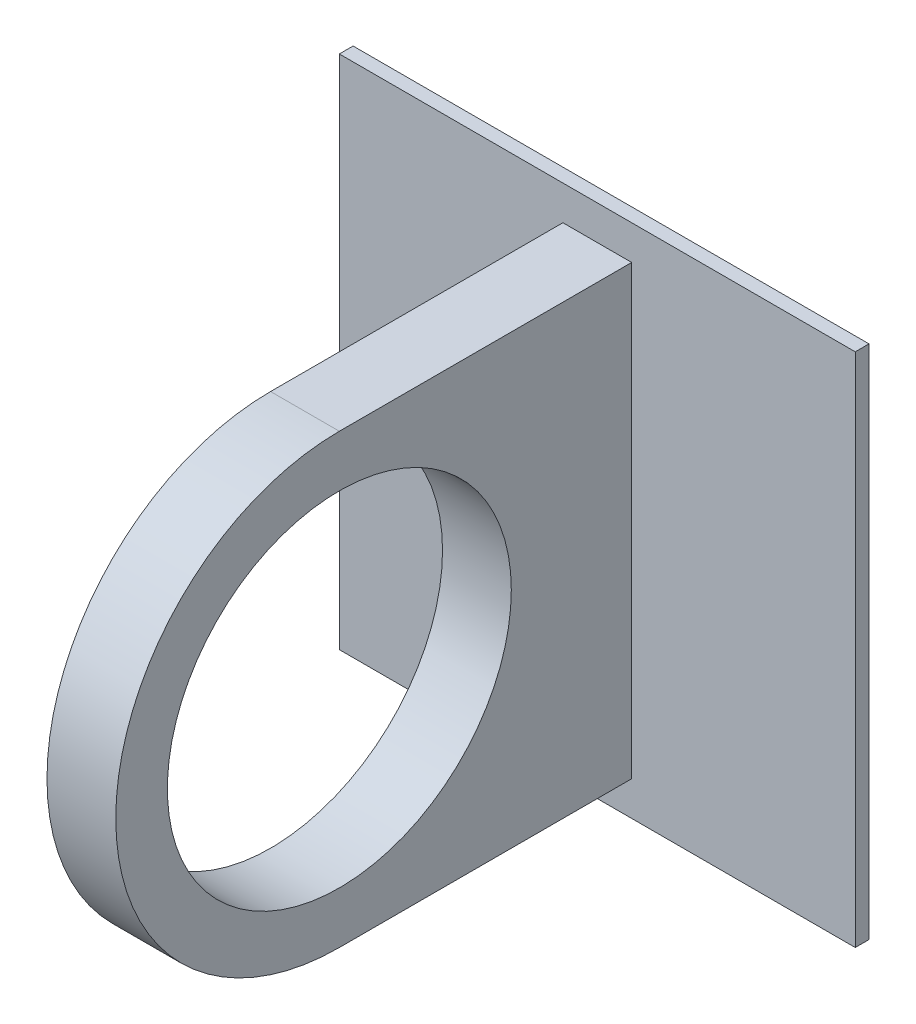
from build123d import *

# Parameters (mm, degrees)
SKETCH2_W           = 19.05
SKETCH2_H           = 19.05
BOSS_EXTRUDE1_DEPTH = 0.508
SKETCH3_W           = 2.54
SKETCH3_H           = 16.51
BOSS_EXTRUDE2_DEPTH = 19.05
CUT_EXTRUDE1_REACH  = 26.285
SKETCH4_R           = 6.35
CUT_EXTRUDE2_START  = -2.54
CUT_EXTRUDE2_DEPTH  = 2.54


with BuildPart() as part:
    # Sketch2 → Boss-Extrude1 (new body)
    with BuildSketch(Plane.XY):
        Rectangle(SKETCH2_W, SKETCH2_H)
    extrude(amount=BOSS_EXTRUDE1_DEPTH)

    # Sketch3 → Boss-Extrude2 (add)
    with BuildSketch(Plane.XY.offset(0.508)):
        Rectangle(SKETCH3_W, SKETCH3_H)
    extrude(amount=BOSS_EXTRUDE2_DEPTH)

    # Sketch4 → Cut-Extrude1 (cut, up to next)
    with BuildSketch(Plane(origin=(1.27, 0, 0), x_dir=(0, 0, -1), z_dir=(1, 0, 0)), mode=Mode.PRIVATE) as cut_extrude1_sk1:
        with Locations((-11.303, 0)):
            Circle(SKETCH4_R)
    cut_extrude1_tool1 = extrude(cut_extrude1_sk1.sketch, amount=-CUT_EXTRUDE1_REACH, mode=Mode.PRIVATE) & part.part
    add(cut_extrude1_tool1.solids().sort_by_distance((1.27, 0, 11.303))[0], mode=Mode.SUBTRACT)

    # Sketch9 → Cut-Extrude2 (cut)
    with BuildSketch(Plane(origin=(1.27, 0, 0), x_dir=(0, 0, -1), z_dir=(1, 0, 0)).offset(CUT_EXTRUDE2_START)):
        with BuildLine():
            ThreePointArc((-11.303, 12.7), (-24.003, 0), (-11.303, -12.7))
            ThreePointArc((-11.303, -12.7), (-9.0805, -10.4775), (-11.303, -8.255))
            ThreePointArc((-11.303, -8.255), (-19.558, 0), (-11.303, 8.255))
            ThreePointArc((-11.303, 8.255), (-9.0805, 10.4775), (-11.303, 12.7))
        make_face()
    extrude(amount=CUT_EXTRUDE2_DEPTH, mode=Mode.SUBTRACT)


solid = part.part
